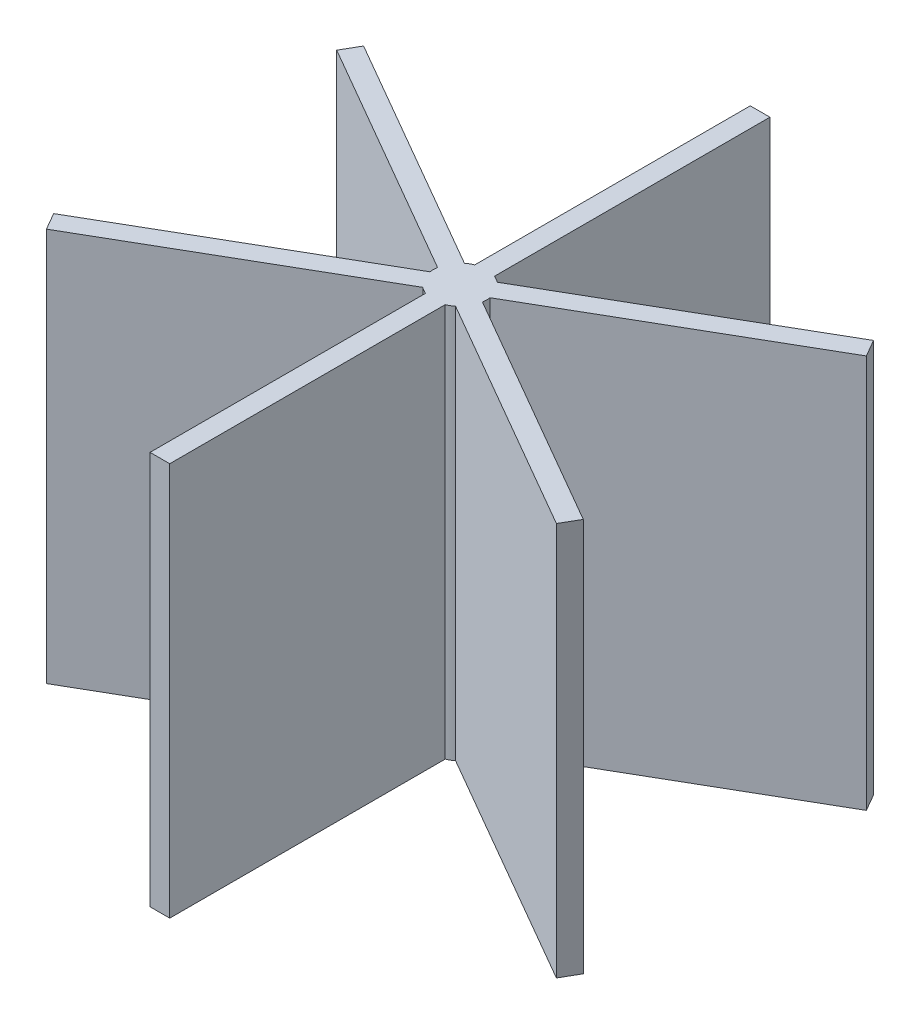
from build123d import *

# Parameters (mm, degrees)
BOSS_EXTRUDE1_DEPTH = 50.8


with BuildPart() as part:
    # Sketch1 → Boss-Extrude1 (new body)
    with BuildSketch(Plane(origin=(0, 0, 0), x_dir=(1, 0, 0), z_dir=(0, 1, 0))):
        with BuildLine():
            Line((-1.27, 3.175), (-1.27, 38.735))
            Line((-1.27, 38.735), (1.27, 38.735))
            Line((1.27, 38.735), (1.27, 3.175))
            ThreePointArc((1.27, 3.175), (1.709789826, 2.961442849), (2.114630657, 2.687352263))
            Line((2.114630657, 2.687352263), (32.910494016, 20.467352263))
            Line((32.910494016, 20.467352263), (34.180494016, 18.267647737))
            Line((34.180494016, 18.267647737), (3.384630657, 0.487647737))
            ThreePointArc((3.384630657, 0.487647737), (3.419579653, 0), (3.384630657, -0.487647737))
            Line((3.384630657, -0.487647737), (34.180494016, -18.267647737))
            Line((34.180494016, -18.267647737), (32.910494016, -20.467352263))
            Line((32.910494016, -20.467352263), (2.114630657, -2.687352263))
            ThreePointArc((2.114630657, -2.687352263), (1.709789826, -2.961442849), (1.27, -3.175))
            Line((1.27, -3.175), (1.27, -38.735))
            Line((1.27, -38.735), (-1.27, -38.735))
            Line((-1.27, -38.735), (-1.27, -3.175))
            ThreePointArc((-1.27, -3.175), (-1.709789826, -2.961442849), (-2.114630657, -2.687352263))
            Line((-2.114630657, -2.687352263), (-32.910494016, -20.467352263))
            Line((-32.910494016, -20.467352263), (-34.180494016, -18.267647737))
            Line((-34.180494016, -18.267647737), (-3.384630657, -0.487647737))
            ThreePointArc((-3.384630657, -0.487647737), (-3.419579653, 0), (-3.384630657, 0.487647737))
            Line((-3.384630657, 0.487647737), (-34.180494016, 18.267647737))
            Line((-34.180494016, 18.267647737), (-32.910494016, 20.467352263))
            Line((-32.910494016, 20.467352263), (-2.114630657, 2.687352263))
            ThreePointArc((-2.114630657, 2.687352263), (-1.709789826, 2.961442849), (-1.27, 3.175))
        make_face()
    extrude(amount=BOSS_EXTRUDE1_DEPTH)


solid = part.part
